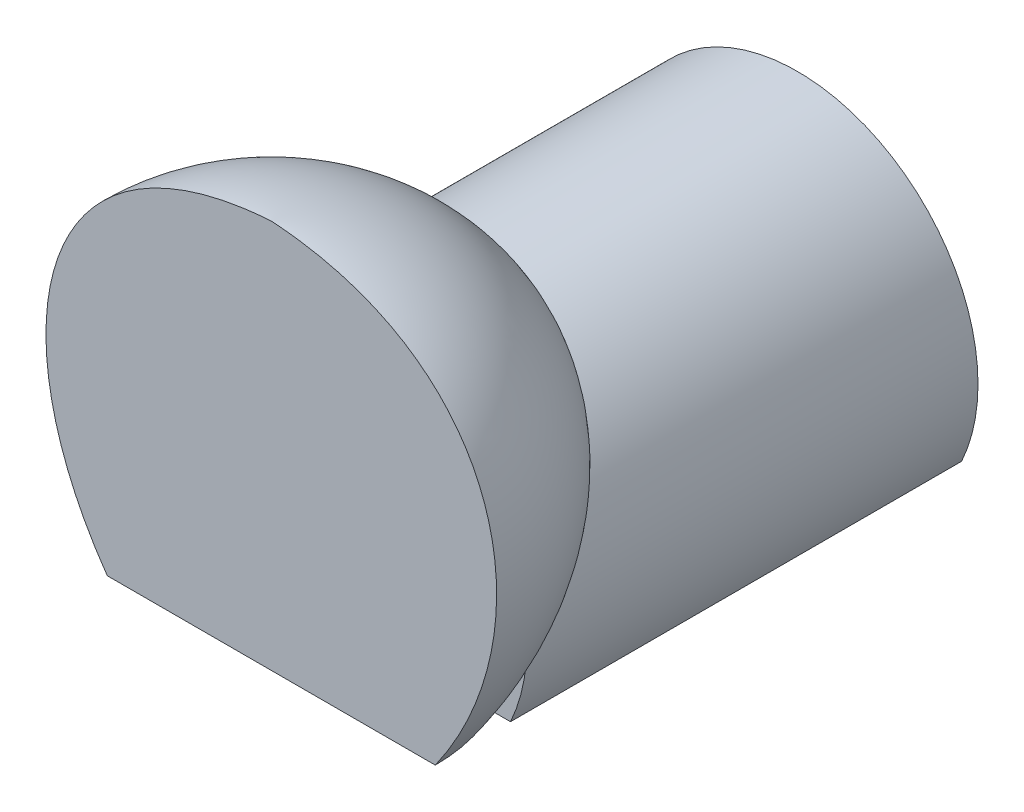
from build123d import *

# Parameters (mm, degrees)
BOSS_EXTRUDE1_DEPTH = 30
REVOLVE1_ANGLE      = 180


with BuildPart() as part:
    # Sketch1 → Boss-Extrude1 (new body)
    with BuildSketch(Plane.XY):
        with BuildLine():
            Line((0, 0), (21.817424229, 0))
            ThreePointArc((21.817424229, 0), (10.908712115, 17), (0, 0))
        make_face()
    extrude(amount=BOSS_EXTRUDE1_DEPTH)


with BuildPart() as body_2:
    # Sketch4 → Revolve1 (revolve)
    with BuildSketch(Plane.XY.offset(35)):
        with BuildLine():
            Line((10.908712115, 0), (10.908712115, 25.884381417))
            add(Edge.make_bspline(
                [(10.908712115, 25.884381417), (26.541224025, 24.862355599), (29.516777115, 10.915057194), (21.817424229, 0)],
                knots=[0, 0, 0, 0, 1, 1, 1, 1], degree=3))
            Line((21.817424229, 0), (10.908712115, 0))
        make_face()
    revolve(axis=Axis((10.908712115, 0, 35), (0, 1, 0)), revolution_arc=REVOLVE1_ANGLE)


solid = Compound([part.part, body_2.part])
